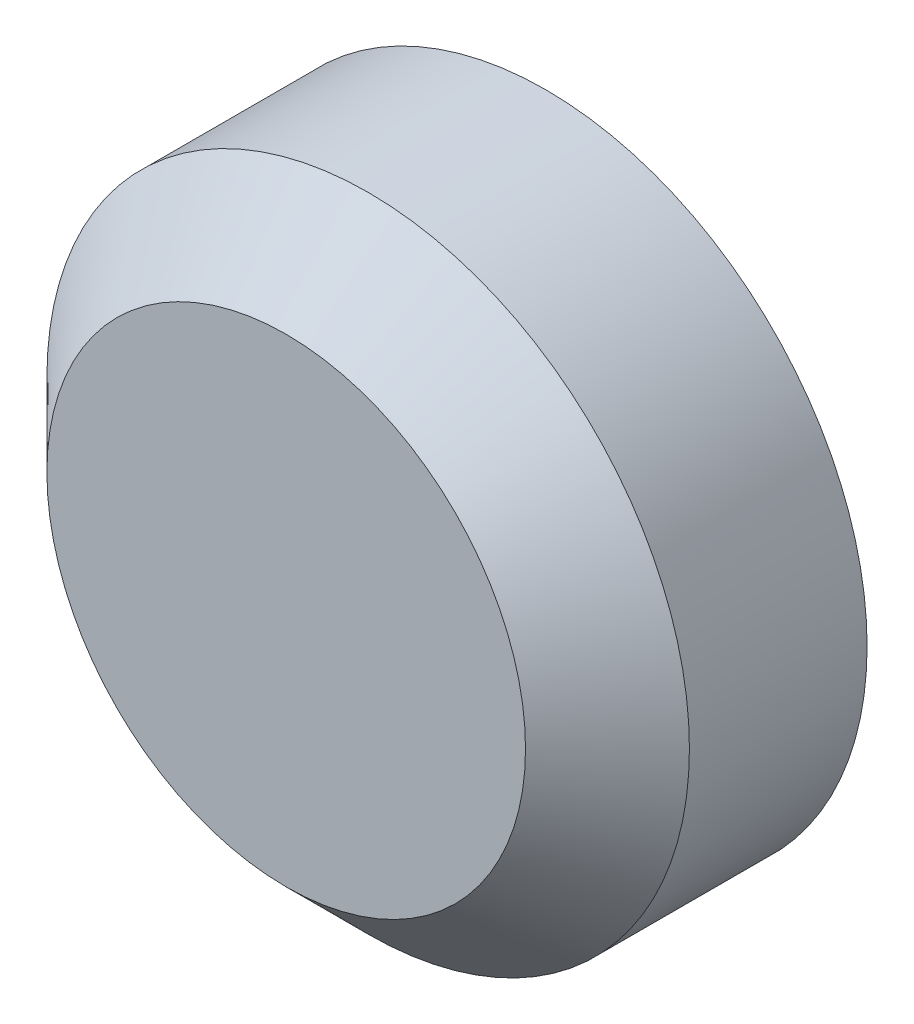
from build123d import *

# Parameters (mm, degrees)
SKETCH1_R           = 6.223
BOSS_EXTRUDE1_DEPTH = 5.0292
CHAMFER1_SIZE       = 1.5875


with BuildPart() as part:
    # Sketch1 → Boss-Extrude1 (new body)
    with BuildSketch(Plane.XY):
        Circle(SKETCH1_R)
    extrude(amount=BOSS_EXTRUDE1_DEPTH)

    # Chamfer1
    chamfer1_edges = [part.edges().sort_by_distance(p)[0] for p in [
        (-6.223, 0, 5.0292),
    ]]
    chamfer(chamfer1_edges, length=CHAMFER1_SIZE)


solid = part.part
